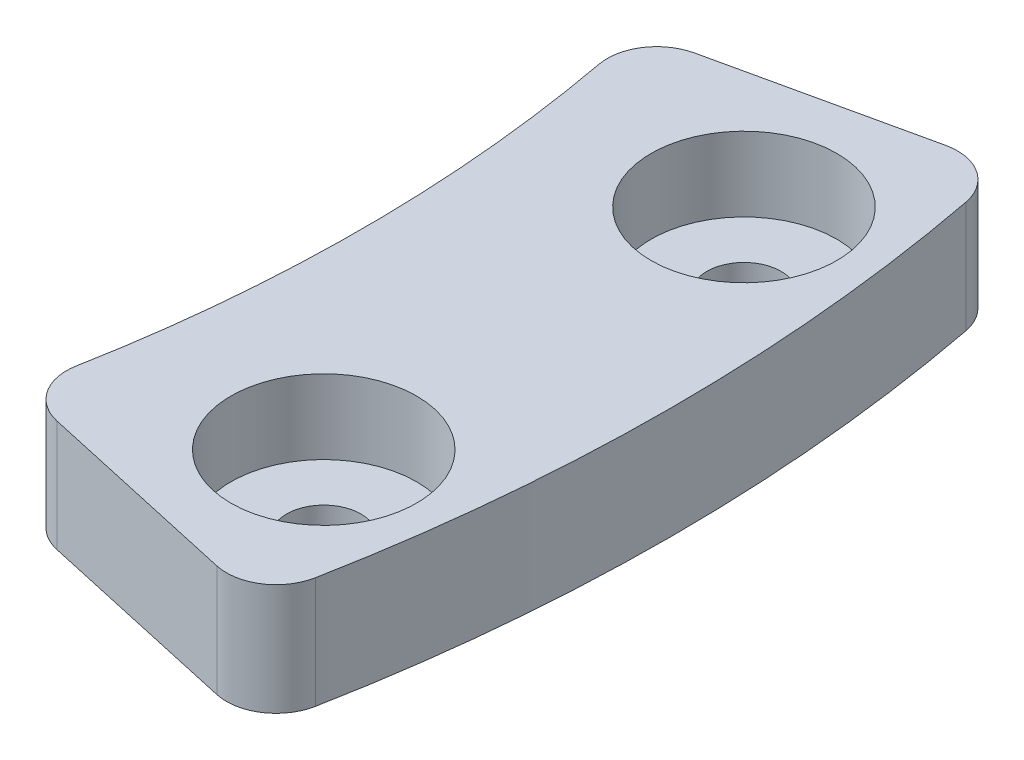
from build123d import *

# Parameters (mm, degrees)
SKETCH_1_R          = 1.5
EXTRUDE_1_DEPTH     = 4.5
FILLET_1_R          = 2
SKETCH_2_R          = 3.75
CUT_EXTRUDE_1_DEPTH = 3


with BuildPart() as part:
    # ｽｹｯﾁ1 → ﾎﾞｽ - 押し出し1 (new body)
    with BuildSketch(Plane(origin=(0, 0, 0), x_dir=(1, 0, 0), z_dir=(0, 1, 0))):
        with BuildLine():
            Line((56.137020409, 12.445277801), (68.340720498, 15.150772976))
            ThreePointArc((68.340720498, 15.150772976), (70, 0), (68.340720498, -15.150772976))
            Line((68.340720498, -15.150772976), (56.137020409, -12.445277801))
            ThreePointArc((56.137020409, -12.445277801), (57.5, 0), (56.137020409, 12.445277801))
        make_face()
        with Locations(Location((64.443915989, 8.484202494, 0), (0, 0, 270))):
            Circle(SKETCH_1_R, mode=Mode.SUBTRACT)
        with Locations(Location((64.443915989, -8.484202494, 0), (0, 0, 90))):
            Circle(SKETCH_1_R, mode=Mode.SUBTRACT)
    extrude(amount=EXTRUDE_1_DEPTH)

    # ﾌｨﾚｯﾄ1
    fillet_1_edges = [part.edges().sort_by_distance(p)[0] for p in [
        (68.340720498, 2.25, 15.150772976),
        (56.137020409, 2.25, 12.445277801),
        (56.137020409, 2.25, -12.445277801),
        (68.340720498, 2.25, -15.150772976),
    ]]
    fillet(fillet_1_edges, radius=FILLET_1_R)

    # ｽｹｯﾁ2 → ｶｯﾄ - 押し出し1 (cut)
    with BuildSketch(Plane(origin=(0, 4.5, 0), x_dir=(1, 0, 0), z_dir=(0, 1, 0))):
        with Locations(Location((64.443915989, 8.484202494, 0), (0, 0, 270))):
            Circle(SKETCH_2_R)
        with Locations(Location((64.443915989, -8.484202494, 0), (0, 0, 270))):
            Circle(SKETCH_2_R)
    extrude(amount=-CUT_EXTRUDE_1_DEPTH, mode=Mode.SUBTRACT)


solid = part.part
